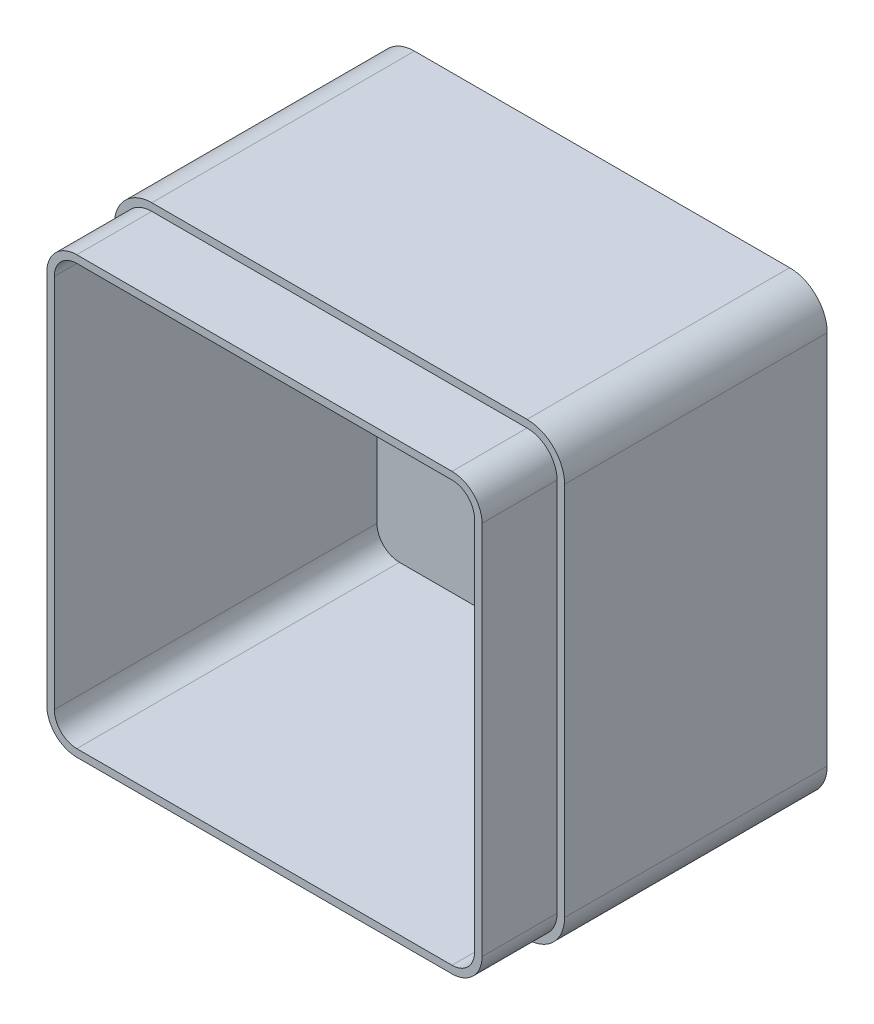
from build123d import *

# Parameters (mm, degrees)
SKETCH1_W           = 120
SKETCH1_H           = 120
BOSS_EXTRUDE2_DEPTH = 70
FILLET1_R           = 10
SHELL2_T            = -4
BOSS_EXTRUDE3_DEPTH = 20
CUT_EXTRUDE3_DEPTH  = 20


with BuildPart() as part:
    # Sketch1 → Boss-Extrude2 (new body)
    with BuildSketch(Plane.XY):
        Rectangle(SKETCH1_W, SKETCH1_H)
    extrude(amount=BOSS_EXTRUDE2_DEPTH)

    # Fillet1
    fillet1_edges = [part.edges().sort_by_distance(p)[0] for p in [
        (60, -60, 35),
        (-60, -60, 35),
        (-60, 60, 35),
        (60, 60, 35),
    ]]
    fillet(fillet1_edges, radius=FILLET1_R)

    # Shell2
    shell2_openings = [part.faces().sort_by_distance(p)[0] for p in [
        (0, 0, 70),
    ]]
    offset(amount=SHELL2_T, openings=shell2_openings, kind=Kind.INTERSECTION)

    # Sketch2 → Boss-Extrude3 (add)
    with BuildSketch(Plane.XY.offset(70)):
        with BuildLine():
            Line((-58, 50), (-58, -50))
            ThreePointArc((-58, -50), (-55.656854249, -55.656854249), (-50, -58))
            Line((-50, -58), (50, -58))
            ThreePointArc((50, -58), (55.656854249, -55.656854249), (58, -50))
            Line((58, -50), (58, 50))
            ThreePointArc((58, 50), (55.656854249, 55.656854249), (50, 58))
            Line((50, 58), (-50, 58))
            ThreePointArc((-50, 58), (-55.656854249, 55.656854249), (-58, 50))
        make_face()
    extrude(amount=BOSS_EXTRUDE3_DEPTH)

    # Sketch4 → Cut-Extrude3 (cut)
    with BuildSketch(Plane.XY.offset(90)):
        with BuildLine():
            Line((56, -50), (56, 50))
            ThreePointArc((56, 50), (54.242640687, 54.242640687), (50, 56))
            Line((50, 56), (-50, 56))
            ThreePointArc((-50, 56), (-54.242640687, 54.242640687), (-56, 50))
            Line((-56, 50), (-56, -50))
            ThreePointArc((-56, -50), (-54.242640687, -54.242640687), (-50, -56))
            Line((-50, -56), (50, -56))
            ThreePointArc((50, -56), (54.242640687, -54.242640687), (56, -50))
        make_face()
    extrude(amount=-CUT_EXTRUDE3_DEPTH, mode=Mode.SUBTRACT)


solid = part.part
